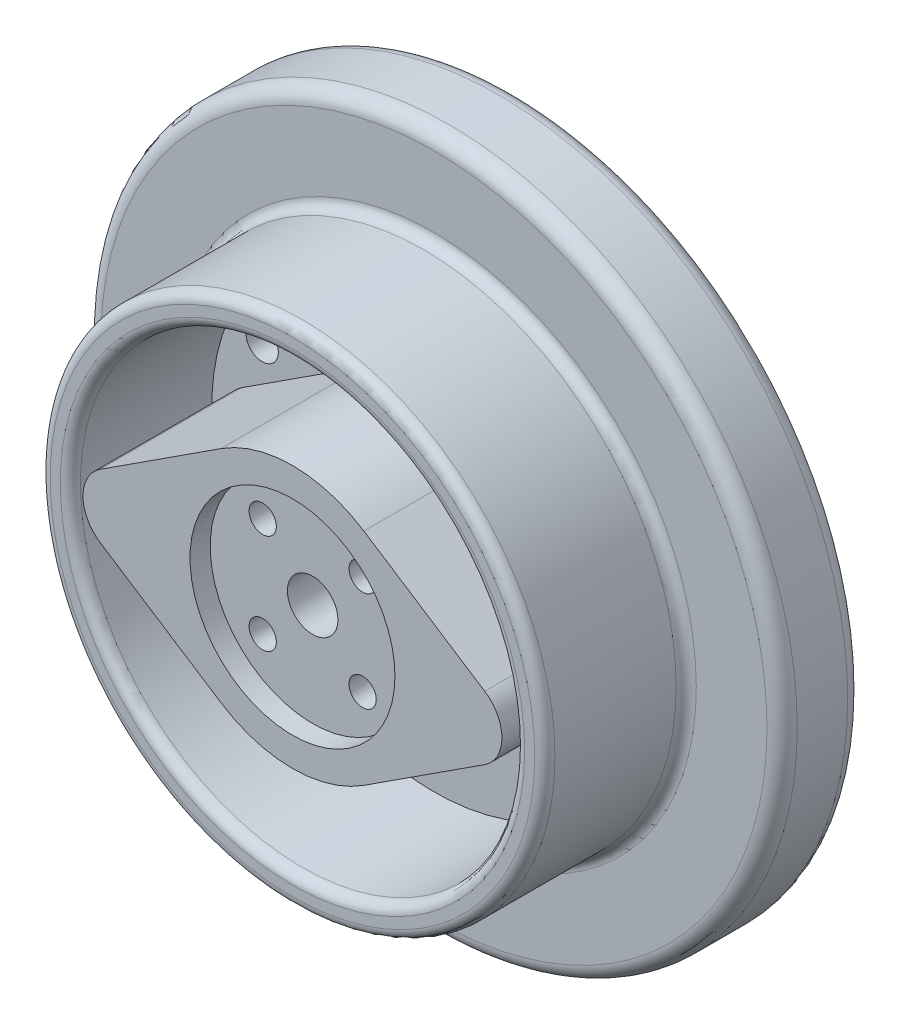
from build123d import *

# Parameters (mm, degrees)
SKETCH_1_R          = 34.5
EXTRUDE_1_DEPTH     = 8
SKETCH_2_R          = 25
SKETCH_2_R_2        = 22
EXTRUDE_2_DEPTH     = 14
FILLET_1_R          = 1
SKETCH_3_R          = 13
SKETCH_3_R_2        = 10.15
EXTRUDE_3_DEPTH     = 14
SKETCH_4_R          = 2.55
SKETCH_4_R_2        = 1.6
CUT_EXTRUDE_1_DEPTH = 51.759235613
SKETCH_7_R          = 10.5
EXTRUDE_5_DEPTH     = 12
CUT_EXTRUDE_2_DEPTH = 15
SKETCH_9_R          = 2.5
SKETCH_9_R_2        = 1.35
CUT_EXTRUDE_3_DEPTH = 53.730446613
SKETCH_10_R         = 2.55
EXTRUDE_6_DEPTH     = 14
SKETCH_11_R         = 2.55
EXTRUDE_7_DEPTH     = 3
FILLET_2_R          = 1
FILLET_3_R          = 1.5
SKETCH_12_R         = 1.65
CUT_EXTRUDE_4_DEPTH = 10


with BuildPart() as part:
    # 草图1 → 凸台-拉伸1 (new body)
    with BuildSketch(Plane.XY):
        Circle(SKETCH_1_R)
    extrude(amount=EXTRUDE_1_DEPTH)

    # 草图2 → 凸台-拉伸2 (add)
    with BuildSketch(Plane.XY.offset(8)):
        Circle(SKETCH_2_R)
        Circle(SKETCH_2_R_2, mode=Mode.SUBTRACT)
    extrude(amount=EXTRUDE_2_DEPTH)

    # 圆角1
    fillet_1_edges = [part.edges().sort_by_distance(p)[0] for p in [
        (-25, 0, 8),
    ]]
    fillet(fillet_1_edges, radius=FILLET_1_R)

    # 草图3 → 凸台-拉伸3 (add)
    with BuildSketch(Plane.XY.offset(8)):
        Circle(SKETCH_3_R)
        Circle(SKETCH_3_R_2, mode=Mode.SUBTRACT)
    extrude(amount=EXTRUDE_3_DEPTH)

    # 草图4 → 切除-拉伸1 (cut, through all)
    with BuildSketch(Plane.XY.offset(8)):
        with Locations((-17, 0)):
            Circle(SKETCH_4_R)
        with Locations((-17, 8)):
            Circle(SKETCH_4_R_2)
        with Locations((-17, -8)):
            Circle(SKETCH_4_R_2)
        with Locations((17, -8)):
            Circle(SKETCH_4_R_2)
        with Locations((17, 0)):
            Circle(SKETCH_4_R)
        with Locations((17, 8)):
            Circle(SKETCH_4_R_2)
    extrude(amount=-CUT_EXTRUDE_1_DEPTH, mode=Mode.SUBTRACT)

    # 草图7 → 凸台-拉伸5 (add)
    with BuildSketch(Plane.XY.offset(8)):
        Circle(SKETCH_7_R)
    extrude(amount=EXTRUDE_5_DEPTH)

    # 草图8 → 切除-拉伸2 (cut)
    with BuildSketch(Plane(origin=(0, 0, 0), x_dir=(-1, 0, 0), z_dir=(0, 0, -1))):
        with BuildLine():
            ThreePointArc((8.61684397, -6), (0, 10.5), (-8.61684397, -6))
            ThreePointArc((-8.61684397, -6), (0, -10.5), (8.61684397, -6))
        make_face()
    extrude(amount=-CUT_EXTRUDE_2_DEPTH, mode=Mode.SUBTRACT)

    # 草图9 → 切除-拉伸3 (cut, through all)
    with BuildSketch(Plane.XY.offset(20)):
        Circle(SKETCH_9_R)
        with Locations((4.949747468, 4.949747468)):
            Circle(SKETCH_9_R_2)
        with Locations((-4.949747468, 4.949747468)):
            Circle(SKETCH_9_R_2)
        with Locations((-4.949747468, -4.949747468)):
            Circle(SKETCH_9_R_2)
        with Locations((4.949747468, -4.949747468)):
            Circle(SKETCH_9_R_2)
    extrude(amount=-CUT_EXTRUDE_3_DEPTH, mode=Mode.SUBTRACT)

    # 草图10 → 凸台-拉伸6 (add)
    # profile 1 of 2: a face of its own
    with BuildSketch(Plane.XY.offset(8)):
        with BuildLine():
            Line((7.073529412, 10.907116102), (19.040441176, 3.146283491))
            ThreePointArc((19.040441176, 3.146283491), (20.75, 0), (19.040441176, -3.146283491))
            Line((19.040441176, -3.146283491), (7.073529412, -10.907116102))
            ThreePointArc((7.073529412, -10.907116102), (13, 0), (7.073529412, 10.907116102))
        make_face()
        with Locations((17, 0)):
            Circle(SKETCH_10_R, mode=Mode.SUBTRACT)
    # profile 2 of 2: a face of its own
    with BuildSketch(Plane.XY.offset(8)):
        with BuildLine():
            Line((-19.040441176, -3.146283491), (-7.073529412, -10.907116102))
            ThreePointArc((-7.073529412, -10.907116102), (-13, 0), (-7.073529412, 10.907116102))
            Line((-7.073529412, 10.907116102), (-19.040441176, 3.146283491))
            ThreePointArc((-19.040441176, 3.146283491), (-20.75, 0), (-19.040441176, -3.146283491))
        make_face()
        with Locations((-17, 0)):
            Circle(SKETCH_10_R, mode=Mode.SUBTRACT)
    extrude(amount=EXTRUDE_6_DEPTH)

    # 草图11 → 凸台-拉伸7 (add)
    with BuildSketch(Plane.XY.offset(22)):
        with Locations((-17, 0)):
            Circle(SKETCH_11_R)
        with Locations((17, 0)):
            Circle(SKETCH_11_R)
    extrude(amount=-EXTRUDE_7_DEPTH)

    # 圆角2
    fillet_2_edges = [part.edges().sort_by_distance(p)[0] for p in [
        (-25, 0, 22),
        (-22, 0, 22),
    ]]
    fillet(fillet_2_edges, radius=FILLET_2_R)

    # 圆角3
    fillet_3_edges = [part.edges().sort_by_distance(p)[0] for p in [
        (-34.5, 0, 0),
        (-34.5, 0, 8),
    ]]
    fillet(fillet_3_edges, radius=FILLET_3_R)

    # 草图12 → 切除-拉伸4 (cut)
    with BuildSketch(Plane.XY.offset(8)):
        with Locations((0, 18)):
            Circle(SKETCH_12_R)
        with Locations((0, -18)):
            Circle(SKETCH_12_R)
    extrude(amount=-CUT_EXTRUDE_4_DEPTH, mode=Mode.SUBTRACT)


solid = part.part
